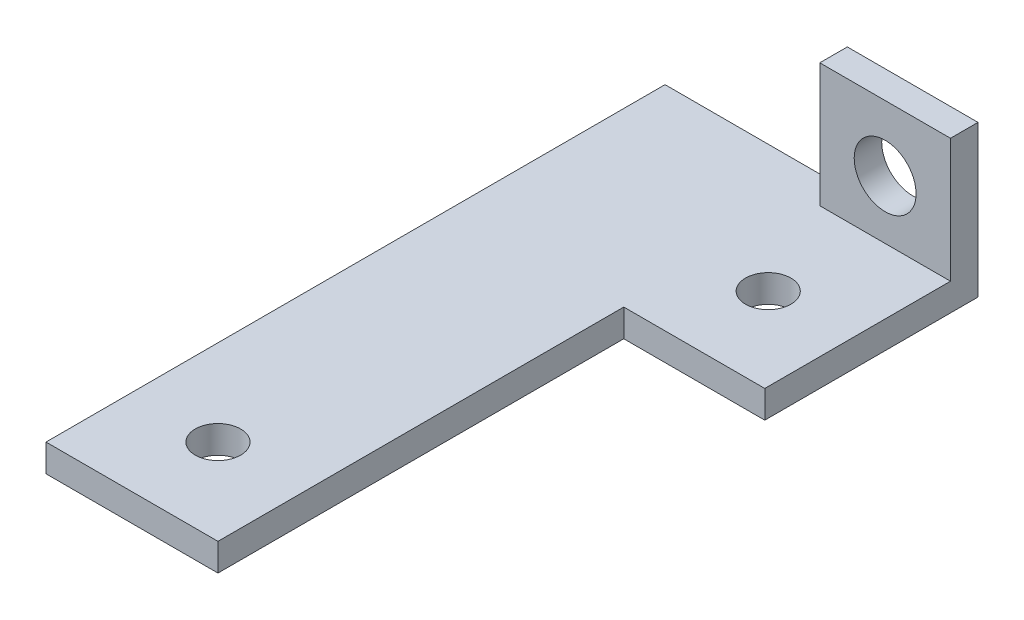
from build123d import *

# Parameters (mm, degrees)
SKETCH1_R           = 3.3
BOSS_EXTRUDE1_DEPTH = 4
SKETCH2_W           = 19
SKETCH2_H           = 4
BOSS_EXTRUDE2_DEPTH = 18
SKETCH3_R           = 4.5
CUT_EXTRUDE1_DEPTH  = 4


with BuildPart() as part:
    # Sketch1 → Boss-Extrude1 (new body)
    with BuildSketch(Plane(origin=(0, 0, 0), x_dir=(1, 0, 0), z_dir=(0, 1, 0))):
        Polygon((0, 0), (25, 0), (25, 59), (45.5, 59), (45.5, 90), (0, 90), align=None)
        with Locations(Location((33.5, 71.5, 0), (0, 0, 270))):
            Circle(SKETCH1_R, mode=Mode.SUBTRACT)
        with Locations(Location((12.5, 12.5, 0), (0, 0, 270))):
            Circle(SKETCH1_R, mode=Mode.SUBTRACT)
    extrude(amount=BOSS_EXTRUDE1_DEPTH)

    # Sketch2 → Boss-Extrude2 (add)
    with BuildSketch(Plane(origin=(0, 4, 0), x_dir=(1, 0, 0), z_dir=(0, 1, 0))):
        with Locations((36, 88)):
            Rectangle(SKETCH2_W, SKETCH2_H)
    extrude(amount=BOSS_EXTRUDE2_DEPTH)

    # Sketch3 → Cut-Extrude1 (cut)
    with BuildSketch(Plane(origin=(0, 0, -90), x_dir=(-1, 0, 0), z_dir=(0, 0, -1))):
        with Locations((-36, 12.5)):
            Circle(SKETCH3_R)
    extrude(amount=-CUT_EXTRUDE1_DEPTH, mode=Mode.SUBTRACT)


solid = part.part
